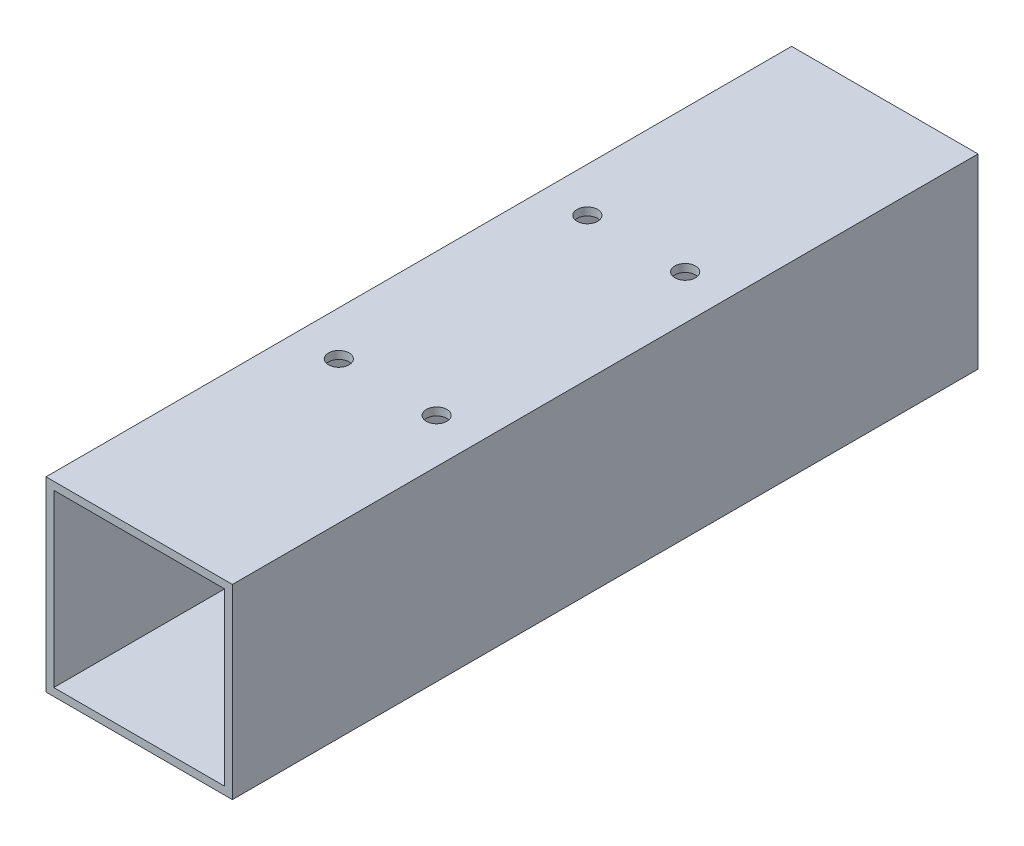
from build123d import *

# Parameters (mm, degrees)
BOSS_EXTRUDE1_DEPTH         = 152.4
BOSS_EXTRUDE1_DEPTH_BACK    = 152.4
SKETCH3_W                   = 76.2
SKETCH3_H                   = 76.2
SKETCH3_W_2                 = 69.85
SKETCH3_H_2                 = 69.85
F_5_16_CLEARANCE_HOLE3_D    = 8.4328
F_1_2_CLEARANCE_HOLE1_D     = 13.49248
F_1_2_CLEARANCE_HOLE1_DEPTH = 3.175
F_1_2_CLEARANCE_HOLE1_TIP   = 4.053549943


with BuildPart() as part:
    # Sketch3 → Boss-Extrude1 (new, two sides: drawn at the far end of the back side and taken through both)
    with BuildSketch(Plane.XY.offset(-BOSS_EXTRUDE1_DEPTH_BACK)):
        Rectangle(SKETCH3_W, SKETCH3_H)
        Rectangle(SKETCH3_W_2, SKETCH3_H_2, mode=Mode.SUBTRACT)
    extrude(amount=BOSS_EXTRUDE1_DEPTH + BOSS_EXTRUDE1_DEPTH_BACK)

    # 5/16 Clearance Hole3 (through all)
    with Locations(Plane(origin=(0, -38.1, 0), x_dir=(-1, 0, 0), z_dir=(0, -1, 0))):
        with Locations((20, 50.8), (-20, -50.8), (-20, 50.8), (20, -50.8)):
            Hole(F_5_16_CLEARANCE_HOLE3_D / 2)

    # 1/2 Clearance Hole1
    with Locations(Plane(origin=(0, -38.1, 0), x_dir=(-1, 0, 0), z_dir=(0, -1, 0))):
        with Locations((-20, 50.8), (20, 50.8), (-20, -50.8), (20, -50.8)):
            Hole(F_1_2_CLEARANCE_HOLE1_D / 2, depth=F_1_2_CLEARANCE_HOLE1_DEPTH)
            with Locations((0, 0, -(F_1_2_CLEARANCE_HOLE1_DEPTH + F_1_2_CLEARANCE_HOLE1_TIP / 2))):  # 118° drill point
                Cone(0, F_1_2_CLEARANCE_HOLE1_D / 2, F_1_2_CLEARANCE_HOLE1_TIP, mode=Mode.SUBTRACT)


solid = part.part
